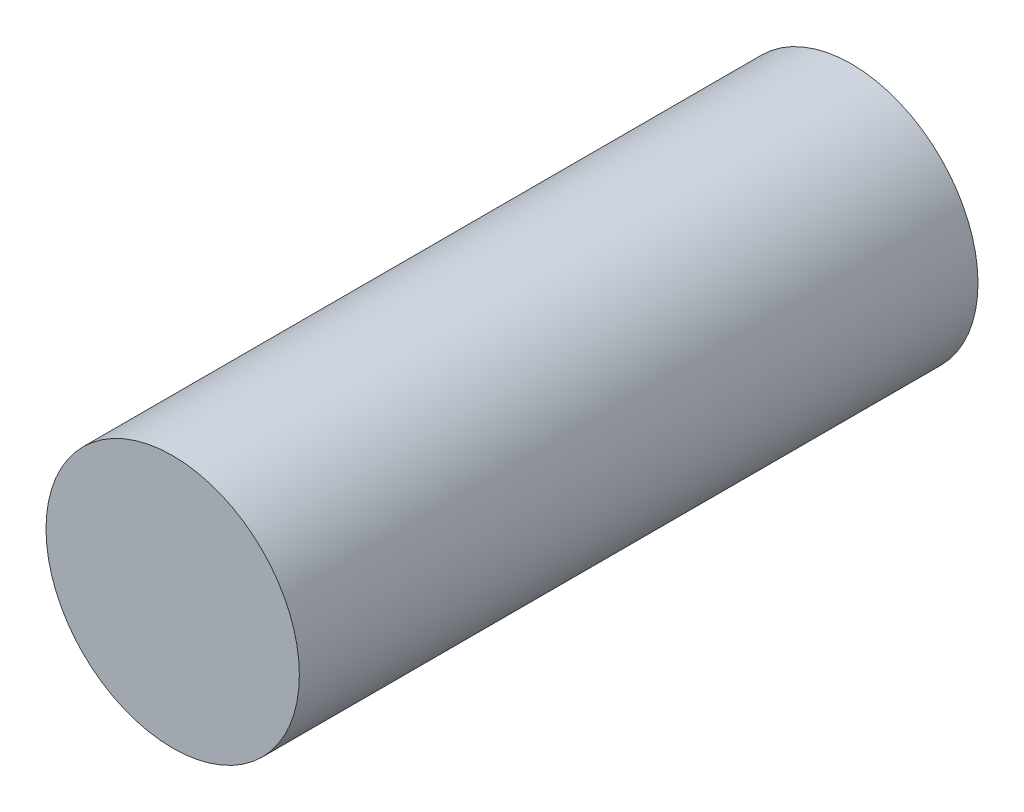
from build123d import *

# Parameters (mm, degrees)
SKETCH1_R           = 5.6
BOSS_EXTRUDE6_DEPTH = 30


with BuildPart() as part:
    # Sketch1 → Boss-Extrude6 (new body)
    with BuildSketch(Plane.XY):
        Circle(SKETCH1_R)
    extrude(amount=BOSS_EXTRUDE6_DEPTH)


solid = part.part
